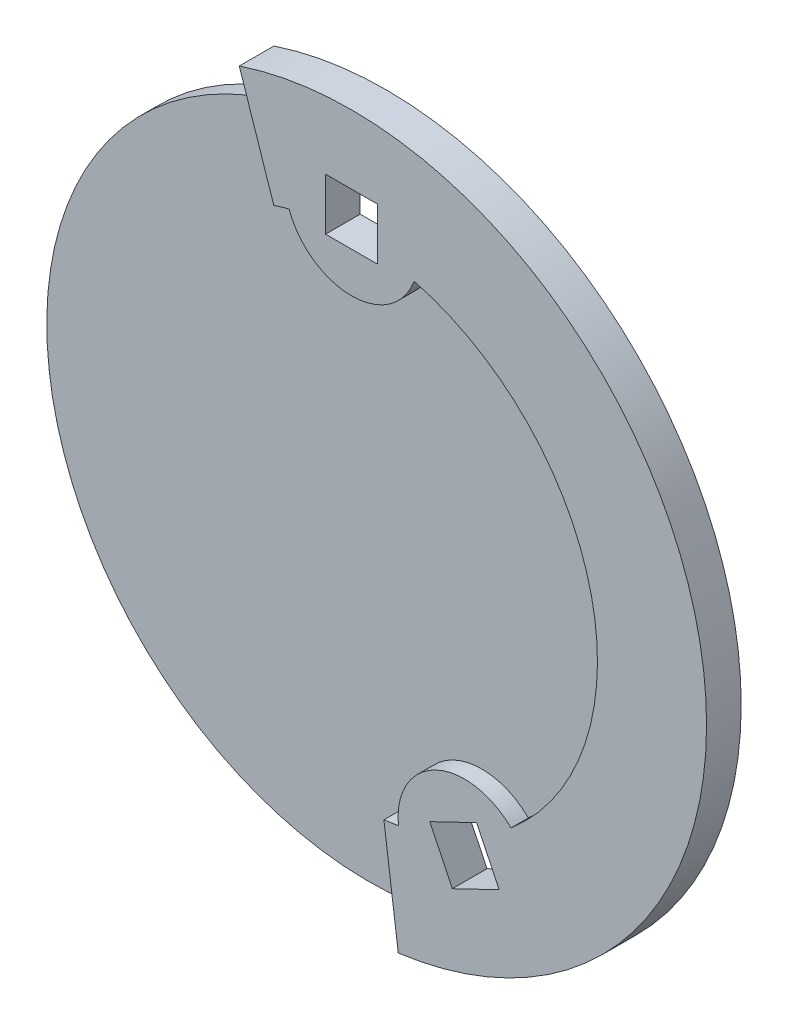
from build123d import *

# Parameters (mm, degrees)
RESSALTO_EXTRUS_O1_DEPTH = 1
RESSALTO_EXTRUS_O2_DEPTH = 1
ESBO_O3_W                = 3
ESBO_O3_H                = 3
CORTE_EXTRUS_O1_DEPTH    = 30.060282173


with BuildPart() as part:
    # Esboço1 → Ressalto-extrusão1 (new body)
    with BuildSketch(Plane.XY):
        with BuildLine():
            Line((-5.882044961, 17.645439838), (-6.482899016, 19.447931004))
            ThreePointArc((-6.482899016, 19.447931004), (19.9860222, 4.561679146), (2.597250835, -20.334804845))
            Line((2.597250835, -20.334804845), (2.356530026, -18.450115616))
            ThreePointArc((2.356530026, -18.450115616), (-18.133659167, -4.138889372), (-5.882044961, 17.645439838))
        make_face()
    extrude(amount=RESSALTO_EXTRUS_O1_DEPTH)

    # Esboço2 → Ressalto-extrusão2 (add)
    with BuildSketch(Plane.XY.offset(1)):
        with BuildLine():
            Line((-4.490593465, 13.471249769), (-6.482899016, 19.447931004))
            ThreePointArc((-6.482899016, 19.447931004), (19.974805028, 4.610549218), (2.696693068, -20.321856374))
            Line((2.696693068, -20.321856374), (1.867953247, -14.076602952))
            ThreePointArc((1.867953247, -14.076602952), (2.288152222, -14.014433967), (2.706303705, -13.93972454))
            ThreePointArc((2.706303705, -13.93972454), (4.856795522, -10.085239821), (9.211162742, -10.807149529))
            ThreePointArc((9.211162742, -10.807149529), (13.843976353, 3.159797262), (3.60992442, 13.733479009))
            ThreePointArc((3.60992442, 13.733479009), (0, 11.193771705), (-3.60992442, 13.733479009))
            ThreePointArc((-3.60992442, 13.733479009), (-4.052380602, 13.609489757), (-4.490593465, 13.471249769))
        make_face()
    extrude(amount=RESSALTO_EXTRUS_O2_DEPTH)

    # Esboço3 → Corte-extrusão1 (cut, through all)
    with BuildSketch(Plane(origin=(0, 0, 0), x_dir=(-1, 0, 0), z_dir=(0, 0, -1))):
        Polygon((-7.221547804, -11.538551224), (-4.5186412, -12.840202442), (-5.820292417, -15.543109046), (-8.523199021, -14.241457828), align=None)
        with Locations((0, 15.029187597)):
            Rectangle(ESBO_O3_W, ESBO_O3_H)
    extrude(amount=-CORTE_EXTRUS_O1_DEPTH, mode=Mode.SUBTRACT)


solid = part.part
